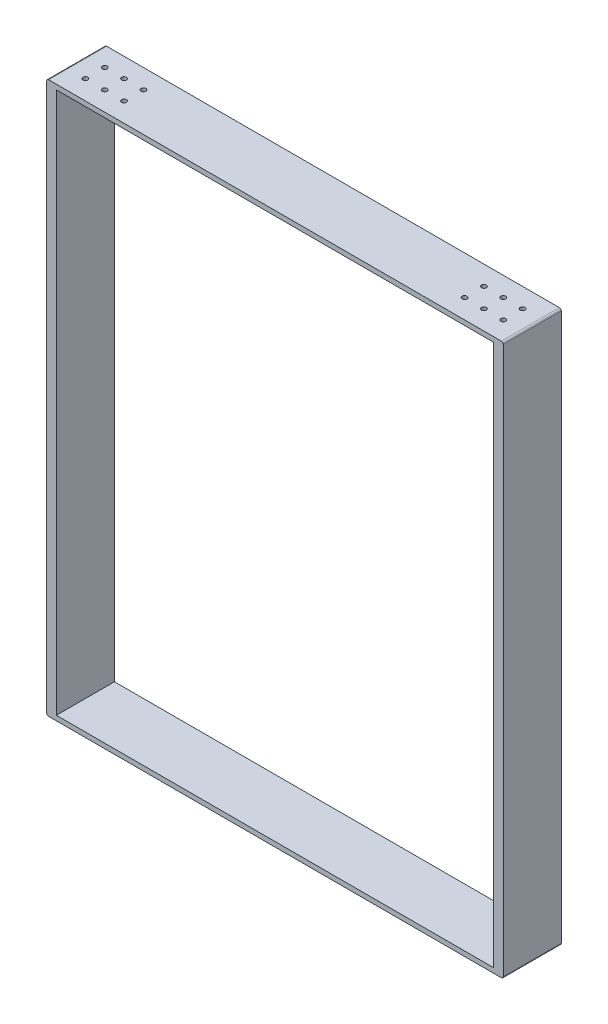
from build123d import *

# Parameters (mm, degrees)
SKETCH1_W           = 599.44
SKETCH1_H           = 723.9
SKETCH1_W_2         = 574.04
SKETCH1_H_2         = 711.2
BOSS_EXTRUDE1_DEPTH = 76.2
CUT_EXTRUDE1_REACH  = 789.191
SKETCH2_R           = 3.175
FILLET1_R           = 2.54


with BuildPart() as part:
    # Sketch1 → Boss-Extrude1 (new body)
    with BuildSketch(Plane.XY):
        Rectangle(SKETCH1_W, SKETCH1_H)
        Rectangle(SKETCH1_W_2, SKETCH1_H_2, mode=Mode.SUBTRACT)
    extrude(amount=BOSS_EXTRUDE1_DEPTH)

    # Sketch2 → Cut-Extrude1 (cut, up to next)
    with BuildSketch(Plane(origin=(0, 361.95, 0), x_dir=(1, 0, 0), z_dir=(0, 1, 0)), mode=Mode.PRIVATE) as cut_extrude1_sk1:
        with Locations(Location((-274.32, -50.8, 0), (0, 0, 270))):
            Circle(SKETCH2_R)
    cut_extrude1_tool1 = extrude(cut_extrude1_sk1.sketch, amount=-CUT_EXTRUDE1_REACH, mode=Mode.PRIVATE) & part.part
    # Sketch2 → Cut-Extrude1 (cut, up to next)
    with BuildSketch(Plane(origin=(0, 361.95, 0), x_dir=(1, 0, 0), z_dir=(0, 1, 0)), mode=Mode.PRIVATE) as cut_extrude1_sk2:
        with Locations(Location((-274.32, -25.4, 0), (0, 0, 270))):
            Circle(SKETCH2_R)
    cut_extrude1_tool2 = extrude(cut_extrude1_sk2.sketch, amount=-CUT_EXTRUDE1_REACH, mode=Mode.PRIVATE) & part.part
    # Sketch2 → Cut-Extrude1 (cut, up to next)
    with BuildSketch(Plane(origin=(0, 361.95, 0), x_dir=(1, 0, 0), z_dir=(0, 1, 0)), mode=Mode.PRIVATE) as cut_extrude1_sk3:
        with Locations(Location((-248.92, -50.8, 0), (0, 0, 270))):
            Circle(SKETCH2_R)
    cut_extrude1_tool3 = extrude(cut_extrude1_sk3.sketch, amount=-CUT_EXTRUDE1_REACH, mode=Mode.PRIVATE) & part.part
    # Sketch2 → Cut-Extrude1 (cut, up to next)
    with BuildSketch(Plane(origin=(0, 361.95, 0), x_dir=(1, 0, 0), z_dir=(0, 1, 0)), mode=Mode.PRIVATE) as cut_extrude1_sk4:
        with Locations(Location((-248.92, -25.4, 0), (0, 0, 270))):
            Circle(SKETCH2_R)
    cut_extrude1_tool4 = extrude(cut_extrude1_sk4.sketch, amount=-CUT_EXTRUDE1_REACH, mode=Mode.PRIVATE) & part.part
    # Sketch2 → Cut-Extrude1 (cut, up to next)
    with BuildSketch(Plane(origin=(0, 361.95, 0), x_dir=(1, 0, 0), z_dir=(0, 1, 0)), mode=Mode.PRIVATE) as cut_extrude1_sk5:
        with Locations(Location((-223.52, -50.8, 0), (0, 0, 270))):
            Circle(SKETCH2_R)
    cut_extrude1_tool5 = extrude(cut_extrude1_sk5.sketch, amount=-CUT_EXTRUDE1_REACH, mode=Mode.PRIVATE) & part.part
    # Sketch2 → Cut-Extrude1 (cut, up to next)
    with BuildSketch(Plane(origin=(0, 361.95, 0), x_dir=(1, 0, 0), z_dir=(0, 1, 0)), mode=Mode.PRIVATE) as cut_extrude1_sk6:
        with Locations(Location((-223.52, -25.4, 0), (0, 0, 270))):
            Circle(SKETCH2_R)
    cut_extrude1_tool6 = extrude(cut_extrude1_sk6.sketch, amount=-CUT_EXTRUDE1_REACH, mode=Mode.PRIVATE) & part.part
    cut_extrude1_1 = cut_extrude1_tool1.solids().sort_by_distance((-274.32, 361.95, 50.8))[0]
    add(cut_extrude1_1, mode=Mode.SUBTRACT)
    cut_extrude1_2 = cut_extrude1_tool2.solids().sort_by_distance((-274.32, 361.95, 25.4))[0]
    add(cut_extrude1_2, mode=Mode.SUBTRACT)
    cut_extrude1_3 = cut_extrude1_tool3.solids().sort_by_distance((-248.92, 361.95, 50.8))[0]
    add(cut_extrude1_3, mode=Mode.SUBTRACT)
    cut_extrude1_4 = cut_extrude1_tool4.solids().sort_by_distance((-248.92, 361.95, 25.4))[0]
    add(cut_extrude1_4, mode=Mode.SUBTRACT)
    cut_extrude1_5 = cut_extrude1_tool5.solids().sort_by_distance((-223.52, 361.95, 50.8))[0]
    add(cut_extrude1_5, mode=Mode.SUBTRACT)
    cut_extrude1_6 = cut_extrude1_tool6.solids().sort_by_distance((-223.52, 361.95, 25.4))[0]
    add(cut_extrude1_6, mode=Mode.SUBTRACT)
    cut_extrude1 = cut_extrude1_1 + cut_extrude1_2 + cut_extrude1_3 + cut_extrude1_4 + cut_extrude1_5 + cut_extrude1_6  # Cut-Extrude1 as one shape, for the pattern or mirror that repeats it

    # Mirror1: Cut-Extrude1 across plane
    add(cut_extrude1.mirror(Plane(origin=(0, 0, 0), x_dir=(0, 0, 1), z_dir=(1, 0, 0))), mode=Mode.SUBTRACT)

    # Fillet1
    fillet1_edges = [part.edges().sort_by_distance(p)[0] for p in [
        (-299.72, -361.95, 38.1),
        (-299.72, 361.95, 38.1),
        (299.72, 361.95, 38.1),
        (299.72, -361.95, 38.1),
    ]]
    fillet(fillet1_edges, radius=FILLET1_R)


solid = part.part
